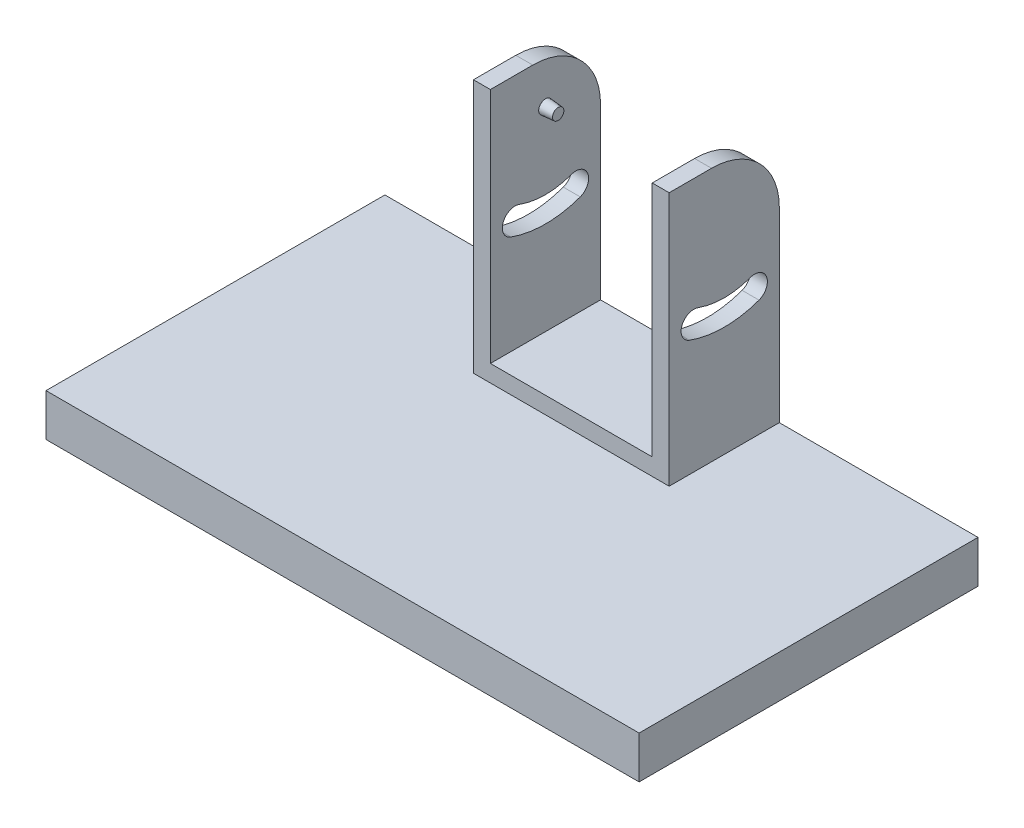
from build123d import *

# Parameters (mm, degrees)
SKETCH2_W               = 19.1
SKETCH2_H               = 13
BOSS_EXTRUDE1_DEPTH     = 2
BOSS_EXTRUDE2_DEPTH     = 2
SKETCH4_R               = 0.8
BOSS_EXTRUDE3_DEPTH     = 1.5
BOSS_EXTRUDE3_TAPER     = 5
CUT_EXTRUDE1_DEPTH      = 38.248624136
CUT_EXTRUDE1_DEPTH_BACK = 38.248624136
SKETCH6_W               = 70
SKETCH6_H               = 40
BOSS_EXTRUDE4_DEPTH     = 5


with BuildPart() as part:
    # Sketch2 → Boss-Extrude1 (new body)
    with BuildSketch(Plane(origin=(0, 0, 0), x_dir=(1, 0, 0), z_dir=(0, 1, 0))):
        Rectangle(SKETCH2_W, SKETCH2_H)
    extrude(amount=BOSS_EXTRUDE1_DEPTH)

    # Sketch3 → Boss-Extrude2 (add)
    with BuildSketch(Plane.ZY.offset(9.55)):
        with BuildLine():
            Line((6.5, 0), (6.5, 30))
            Line((6.5, 30), (1.5, 30))
            ThreePointArc((1.5, 30), (-4.156854249, 27.656854249), (-6.5, 22))
            Line((-6.5, 22), (-6.5, 0))
            Line((-6.5, 0), (6.5, 0))
        make_face()
    boss_extrude2 = extrude(amount=BOSS_EXTRUDE2_DEPTH)

    # Sketch4 → Boss-Extrude3 (add)
    with BuildSketch(Plane(origin=(-9.55, 0, 0), x_dir=(0, 0, -1), z_dir=(1, 0, 0))):
        with Locations((0, 25)):
            Circle(SKETCH4_R)
    boss_extrude3 = extrude(amount=BOSS_EXTRUDE3_DEPTH, taper=BOSS_EXTRUDE3_TAPER)

    # Mirror1: Boss-Extrude2, Boss-Extrude3 across plane
    add(boss_extrude2.mirror(Plane(origin=(0, 0, 0), x_dir=(0, 0, 1), z_dir=(1, 0, 0))))
    add(boss_extrude3.mirror(Plane(origin=(0, 0, 0), x_dir=(0, 0, 1), z_dir=(1, 0, 0))))

    # Sketch5 → Cut-Extrude1 (cut, two sides: drawn at the far end of the back side and taken through both)
    with BuildSketch(Plane(origin=(-9.55, 0, 0), x_dir=(0, 0, -1), z_dir=(1, 0, 0)).offset(-CUT_EXTRUDE1_DEPTH_BACK)):
        with BuildLine():
            ThreePointArc((3.07818129, 16.542766413), (5.000750436, 15.646257697), (4.10424172, 13.723688551))
            ThreePointArc((4.10424172, 13.723688551), (0, 13), (-4.10424172, 13.723688551))
            ThreePointArc((-4.10424172, 13.723688551), (-5.000750436, 15.646257697), (-3.07818129, 16.542766413))
            ThreePointArc((-3.07818129, 16.542766413), (0, 16), (3.07818129, 16.542766413))
        make_face()
    extrude(amount=CUT_EXTRUDE1_DEPTH + CUT_EXTRUDE1_DEPTH_BACK, mode=Mode.SUBTRACT)

    # Sketch6 → Boss-Extrude4 (add)
    with BuildSketch(Plane.XZ):
        with Locations((0, 13.5)):
            Rectangle(SKETCH6_W, SKETCH6_H)
    extrude(amount=BOSS_EXTRUDE4_DEPTH)


solid = part.part
